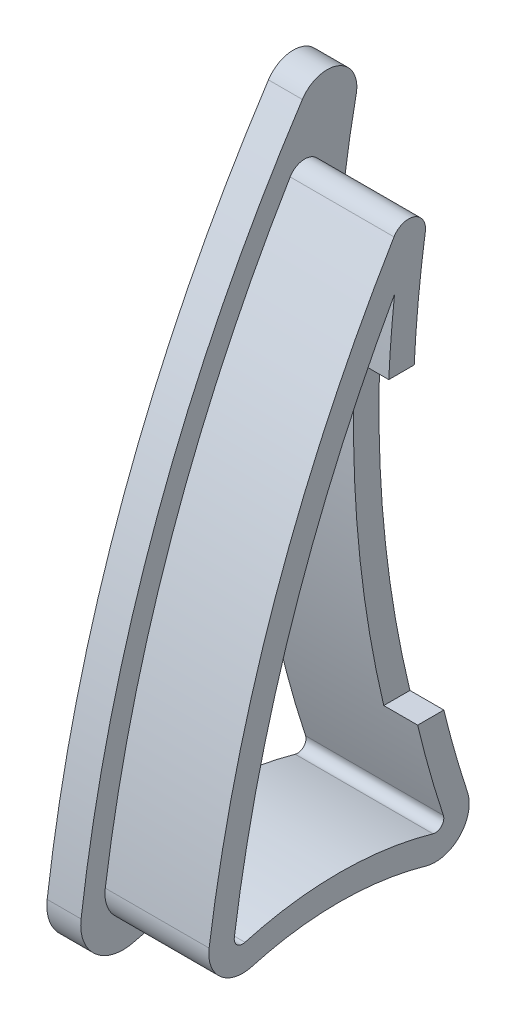
from build123d import *

# Parameters (mm, degrees)
BOSS_EXTRUDE1_DEPTH = 76.2
SKETCH2_W           = 6.985
SKETCH2_H           = 9.525
CUT_EXTRUDE1_DEPTH  = 119.84173867
CUT_EXTRUDE2_DEPTH  = 119.84173867
CUT_EXTRUDE3_DEPTH  = 119.84173867
FILLET1_R           = 2.54
CUT_EXTRUDE4_DEPTH  = 5.08
CUT_EXTRUDE6_DEPTH  = 15.113
FILLET2_R           = 0.508
BOSS_EXTRUDE2_DEPTH = 15.5575
BOSS_EXTRUDE3_DEPTH = 5.08
CUT_EXTRUDE7_DEPTH  = 5.08


with BuildPart() as part:
    # Sketch1 → Boss-Extrude1 (new body)
    with BuildSketch(Plane.XY):
        Polygon((-15.5575, 76.2), (15.5575, 76.2), (15.5575, -76.2), (7.845485509, -76.2), (9.525, -85.725), (-9.525, -85.725), (-7.845485509, -76.2), (-15.5575, -76.2), align=None)
    extrude(amount=BOSS_EXTRUDE1_DEPTH)

    # Sketch2 → Cut-Extrude1 (cut, through all)
    with BuildSketch(Plane(origin=(15.5575, 0, 0), x_dir=(0, 0, -1), z_dir=(1, 0, 0))):
        with Locations((-3.4925, -80.9625)):
            Rectangle(SKETCH2_W, SKETCH2_H)
    extrude(amount=-CUT_EXTRUDE1_DEPTH, mode=Mode.SUBTRACT)

    # Sketch3 → Cut-Extrude2 (cut, through all)
    with BuildSketch(Plane(origin=(15.5575, 0, 0), x_dir=(0, 0, -1), z_dir=(1, 0, 0))):
        with BuildLine():
            Line((-76.2, -85.725), (-76.2, -76.2))
            Line((-76.2, -76.2), (-76.2, 76.2))
            Line((-76.2, 76.2), (-6.541803462, 76.2))
            ThreePointArc((-6.541803462, 76.2), (-58.046669251, 2.411215556), (-76.2, -85.725))
        make_face()
        with BuildLine():
            Line((0, -76.2), (0, 67.75939176))
            ThreePointArc((0, 67.75939176), (-18.20597202, -4.22030412), (0, -76.2))
        make_face()
    extrude(amount=-CUT_EXTRUDE2_DEPTH, mode=Mode.SUBTRACT)

    # Sketch6 → Cut-Extrude3 (cut, through all)
    with BuildSketch(Plane(origin=(15.5575, 0, 0), x_dir=(0, 0, -1), z_dir=(1, 0, 0))):
        with BuildLine():
            ThreePointArc((-28.934409948, -61.883434575), (-23.879909813, -60.517759582), (-22.716254779, -55.412963136))
            ThreePointArc((-22.716254779, -55.412963136), (-30.753414225, -11.294498854), (-26.546552055, 33.352305435))
            ThreePointArc((-26.546552055, 33.352305435), (-49.181053892, -9.446405872), (-61.429710833, -56.286781256))
            ThreePointArc((-61.429710833, -56.286781256), (-59.737369376, -60.827463042), (-55.008021131, -61.883434575))
            ThreePointArc((-55.008021131, -61.883434575), (-41.971215539, -60.062859411), (-28.934409948, -61.883434575))
        make_face()
    extrude(amount=-CUT_EXTRUDE3_DEPTH, mode=Mode.SUBTRACT)

    # Fillet1
    fillet1_edges = [part.edges().sort_by_distance(p)[0] for p in [
        (0, 33.352305435, 26.546552055),
    ]]
    fillet(fillet1_edges, radius=FILLET1_R)

    # Sketch7 → Cut-Extrude4 (cut, symmetric)
    with BuildSketch(Plane(origin=(0, 0, 0), x_dir=(0, 0, -1), z_dir=(1, 0, 0))):
        with BuildLine():
            Line((-30.699128799, 4.016230293), (-17.981752538, 4.016230293))
            ThreePointArc((-17.981752538, 4.016230293), (-17.415803594, -19.667907964), (-13.161921654, -42.973769707))
            Line((-13.161921654, -42.973769707), (-26.264177108, -42.973769707))
            ThreePointArc((-26.264177108, -42.973769707), (-30.179968378, -19.639057999), (-30.699128799, 4.016230293))
        make_face()
    extrude(amount=CUT_EXTRUDE4_DEPTH, both=True, mode=Mode.SUBTRACT)

    # Sketch10 → Cut-Extrude6 (cut, symmetric)
    with BuildSketch(Plane(origin=(15.5575, 76.2, 6.541803462), x_dir=(-1, 0, 0), z_dir=(0, -0.7903999954772005, -0.6125910929401777))):
        Polygon((0, 5.170641427), (6.985, 5.170641427), (0, -3.655858573), align=None)
        Polygon((31.115, 5.170641427), (31.115, -3.655858573), (24.13, 5.170641427), align=None)
    extrude(amount=CUT_EXTRUDE6_DEPTH, both=True, mode=Mode.SUBTRACT)

    # Fillet2
    fillet2_edges = [part.edges().sort_by_distance(p)[0] for p in [
        (-15.5575, 5.090891194, 56.873019023),
        (-14.111333502, 74.930435776, 7.871138317),
        (0, 76.2, 6.541803462),
        (15.5575, 5.090891194, 56.873019023),
        (14.111333502, 74.930435776, 7.871138317),
    ]]
    fillet(fillet2_edges, radius=FILLET2_R)


with BuildPart() as body_2:
    # Sketch11 → Boss-Extrude2 (new body)
    with BuildSketch(Plane(origin=(15.5575, 0, 0), x_dir=(0, 0, -1), z_dir=(1, 0, 0))):
        with BuildLine():
            ThreePointArc((-61.429710833, -56.286781256), (-59.737369376, -60.827463042), (-55.008021131, -61.883434575))
            ThreePointArc((-55.008021131, -61.883434575), (-41.971215539, -60.062859411), (-28.934409948, -61.883434575))
            ThreePointArc((-28.934409948, -61.883434575), (-23.879909813, -60.517759582), (-22.716254779, -55.412963136))
            ThreePointArc((-22.716254779, -55.412963136), (-30.33926448, -17.846197276), (-29.038721333, 20.464124591))
            ThreePointArc((-29.038721333, 20.464124591), (-30.691356883, 23.236746406), (-33.730314595, 22.14891737))
            ThreePointArc((-33.730314595, 22.14891737), (-51.496194807, -15.685940761), (-61.429710833, -56.286781256))
        make_face()
        with BuildLine():
            ThreePointArc((-57.657212561, -56.820032407), (-57.234127197, -57.955202853), (-56.051790136, -58.219195736))
            ThreePointArc((-56.051790136, -58.219195736), (-41.971215539, -56.252859411), (-27.890640943, -58.219195736))
            ThreePointArc((-27.890640943, -58.219195736), (-26.62701591, -57.877776988), (-26.336102151, -56.601577877))
            ThreePointArc((-26.336102151, -56.601577877), (-33.838316864, -21.365349504), (-33.651053161, 14.660196264))
            ThreePointArc((-33.651053161, 14.660196264), (-48.944068981, -19.975014906), (-57.657212561, -56.820032407))
        make_face(mode=Mode.SUBTRACT)
    extrude(amount=-BOSS_EXTRUDE2_DEPTH)

    # Sketch13 → Cut-Extrude7 (cut, symmetric)
    with BuildSketch(Plane(origin=(0, 0, 0), x_dir=(0, 0, -1), z_dir=(1, 0, 0))):
        with BuildLine():
            Line((-17.981752538, 4.016230293), (-34.513828125, 4.016230293))
            ThreePointArc((-34.513828125, 4.016230293), (-34.007192205, -19.631694302), (-30.182465628, -42.973769707))
            Line((-30.182465628, -42.973769707), (-13.161921654, -42.973769707))
            ThreePointArc((-13.161921654, -42.973769707), (-17.415803594, -19.667907964), (-17.981752538, 4.016230293))
        make_face()
    extrude(amount=CUT_EXTRUDE7_DEPTH, both=True, mode=Mode.SUBTRACT)


with BuildPart() as body_3:
    # Sketch12 → Boss-Extrude3 (new body)
    with BuildSketch(Plane(origin=(15.5575, 0, 0), x_dir=(0, 0, -1), z_dir=(1, 0, 0))):
        with BuildLine():
            ThreePointArc((-23.831738773, 27.962776346), (-26.492538641, 32.964962799), (-31.905127941, 31.28996957))
            ThreePointArc((-31.905127941, 31.28996957), (-53.570754409, -11.710044351), (-65.056281593, -58.469890723))
            ThreePointArc((-65.056281593, -58.469890723), (-62.925669808, -64.071096093), (-57.083298558, -65.405152448))
            ThreePointArc((-57.083298558, -65.405152448), (-41.422387692, -63.30256815), (-25.761476826, -65.405152448))
            ThreePointArc((-25.761476826, -65.405152448), (-19.442461008, -63.610654229), (-18.093267187, -57.18182379))
            ThreePointArc((-18.093267187, -57.18182379), (-26.733177439, -14.998448579), (-23.831738773, 27.962776346))
        make_face()
        with BuildLine():
            ThreePointArc((-27.890640943, -58.219195736), (-26.62701591, -57.877776988), (-26.336102151, -56.601577877))
            ThreePointArc((-26.336102151, -56.601577877), (-33.838316864, -21.365349504), (-33.651053161, 14.660196264))
            ThreePointArc((-33.651053161, 14.660196264), (-48.944068981, -19.975014906), (-57.657212561, -56.820032407))
            ThreePointArc((-57.657212561, -56.820032407), (-57.234127197, -57.955202853), (-56.051790136, -58.219195736))
            ThreePointArc((-56.051790136, -58.219195736), (-41.971215539, -56.252859411), (-27.890640943, -58.219195736))
        make_face(mode=Mode.SUBTRACT)
    extrude(amount=BOSS_EXTRUDE3_DEPTH)


with BuildPart() as body_2_1:
    add(body_2.part)

    # Combine1: union body 3
    add(body_3.part)


with BuildPart() as body_2_2:
    # Mirror1: mirrored copy
    add(body_2_1.part.mirror(Plane(origin=(0, -71.361391395, -45.215986197), x_dir=(0, 0, 1), z_dir=(1, 0, 0))))


solid = body_2_2.part
